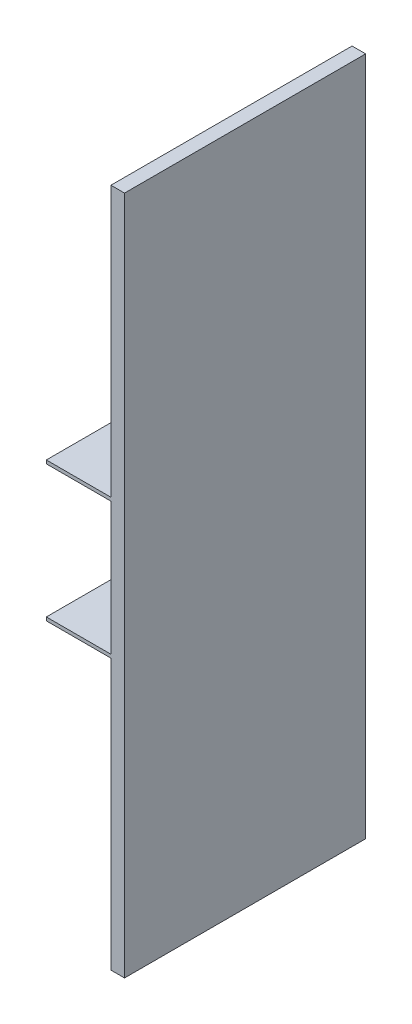
from build123d import *

# Parameters (mm, degrees)
SKETCH1_W           = 23
SKETCH1_H           = 70.95
BOSS_EXTRUDE1_DEPTH = 200
SKETCH2_W           = 19
SKETCH2_H           = 70.95
CUT_EXTRUDE1_DEPTH  = 204.447107684
SKETCH3_W           = 70.95
SKETCH3_H           = 1
BOSS_EXTRUDE2_DEPTH = 19


with BuildPart() as part:
    # Sketch1 → Boss-Extrude1 (new body)
    with BuildSketch(Plane(origin=(0, 0, 0), x_dir=(1, 0, 0), z_dir=(0, 1, 0))):
        Rectangle(SKETCH1_W, SKETCH1_H)
    extrude(amount=BOSS_EXTRUDE1_DEPTH)

    # Sketch2 → Cut-Extrude1 (cut, through all)
    with BuildSketch(Plane(origin=(0, 200, 0), x_dir=(1, 0, 0), z_dir=(0, 1, 0))):
        with Locations((-2, 0)):
            Rectangle(SKETCH2_W, SKETCH2_H)
    extrude(amount=-CUT_EXTRUDE1_DEPTH, mode=Mode.SUBTRACT)

    # Sketch3 → Boss-Extrude2 (add)
    with BuildSketch(Plane.ZY.offset(-7.5)):
        with Locations((0, 80)):
            Rectangle(SKETCH3_W, SKETCH3_H)
        with Locations((0, 120)):
            Rectangle(SKETCH3_W, SKETCH3_H)
    extrude(amount=BOSS_EXTRUDE2_DEPTH)


solid = part.part
